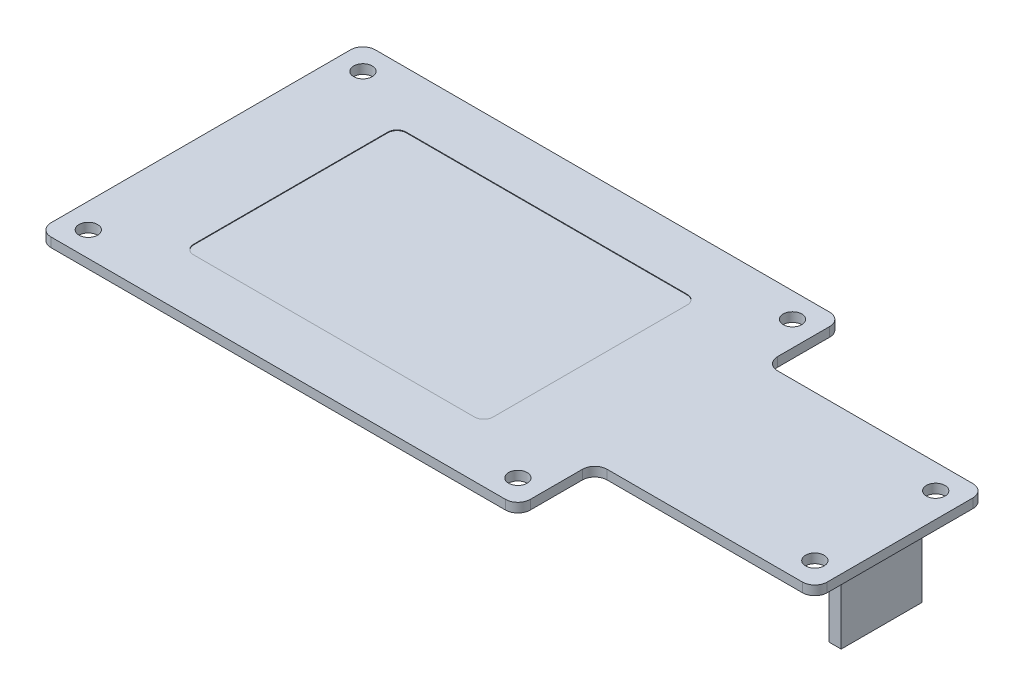
from build123d import *

# Parameters (mm, degrees)
BOSS_EXTRUDE1_DEPTH     = 0.75
FILLET1_R               = 2
SKETCH2_R               = 1.5
CUT_EXTRUDE1_DEPTH      = 1.5
CUT_EXTRUDE2_DEPTH      = 0.1
CUT_EXTRUDE2_DEPTH_BACK = 0.1
SKETCH5_W               = 2
SKETCH5_H               = 13
BOSS_EXTRUDE2_DEPTH     = 12


with BuildPart() as part:
    # Sketch1 → Boss-Extrude1 (new, symmetric)
    with BuildSketch(Plane(origin=(0, 0, 0), x_dir=(1, 0, 0), z_dir=(0, 1, 0))):
        Polygon((-38.65, 26.15), (38.65, 26.15), (38.65, 13.75), (74.15, 13.75), (74.15, -13.75), (38.65, -13.75), (38.65, -26.15), (-38.65, -26.15), align=None)
    extrude(amount=BOSS_EXTRUDE1_DEPTH, both=True)

    # Fillet1
    fillet1_edges = [part.edges().sort_by_distance(p)[0] for p in [
        (38.65, 0, -13.75),
        (74.15, 0, -13.75),
        (74.15, 0, 13.75),
        (38.65, 0, 13.75),
        (38.65, 0, 26.15),
        (-38.65, 0, 26.15),
        (-38.65, 0, -26.15),
        (38.65, 0, -26.15),
    ]]
    fillet(fillet1_edges, radius=FILLET1_R)

    # Sketch2 → Cut-Extrude1 (cut)
    with BuildSketch(Plane(origin=(0, 0.75, 0), x_dir=(1, 0, 0), z_dir=(0, 1, 0))):
        with Locations(Location((-34.65, 22.15, 0), (0, 0, 270))):
            Circle(SKETCH2_R)
        with Locations(Location((34.65, 22.15, 0), (0, 0, 270))):
            Circle(SKETCH2_R)
        with Locations(Location((34.65, -22.15, 0), (0, 0, 270))):
            Circle(SKETCH2_R)
        with Locations(Location((-34.65, -22.15, 0), (0, 0, 270))):
            Circle(SKETCH2_R)
        with Locations(Location((70.15, 9.75, 0), (0, 0, 270))):
            Circle(SKETCH2_R)
        with Locations(Location((70.15, -9.75, 0), (0, 0, 270))):
            Circle(SKETCH2_R)
    extrude(amount=-CUT_EXTRUDE1_DEPTH, mode=Mode.SUBTRACT)

    # Sketch4 → Cut-Extrude2 (cut, two sides: drawn at the far end of the back side and taken through both)
    with BuildSketch(Plane(origin=(0, 0.75, 0), x_dir=(1, 0, 0), z_dir=(0, 1, 0)).offset(-CUT_EXTRUDE2_DEPTH_BACK)):
        with BuildLine():
            Line((-22.65, 17.15), (22.65, 17.15))
            ThreePointArc((22.65, 17.15), (23.710660172, 16.710660172), (24.15, 15.65))
            Line((24.15, 15.65), (24.15, -15.65))
            ThreePointArc((24.15, -15.65), (23.710660172, -16.710660172), (22.65, -17.15))
            Line((22.65, -17.15), (-22.65, -17.15))
            ThreePointArc((-22.65, -17.15), (-23.710660172, -16.710660172), (-24.15, -15.65))
            Line((-24.15, -15.65), (-24.15, 15.65))
            ThreePointArc((-24.15, 15.65), (-23.710660172, 16.710660172), (-22.65, 17.15))
        make_face()
    extrude(amount=CUT_EXTRUDE2_DEPTH + CUT_EXTRUDE2_DEPTH_BACK, mode=Mode.SUBTRACT)

    # Sketch5 → Boss-Extrude2 (add)
    with BuildSketch(Plane.XZ.offset(0.75)):
        with Locations((70.15, 0)):
            Rectangle(SKETCH5_W, SKETCH5_H)
    extrude(amount=BOSS_EXTRUDE2_DEPTH)


solid = part.part
